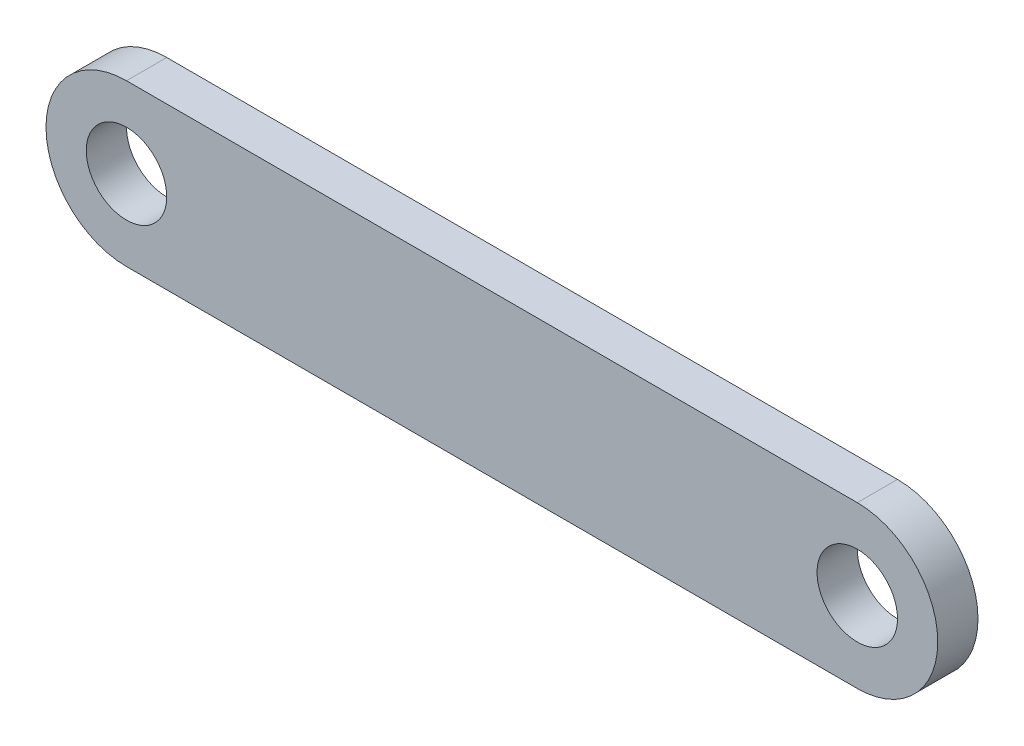
from build123d import *

# Parameters (mm, degrees)
SKETCH1_R      = 1
EXTRUDE1_DEPTH = 1


with BuildPart() as part:
    # Sketch1 → Extrude1 (new body)
    with BuildSketch(Plane.XY):
        with BuildLine():
            ThreePointArc((0, 2), (-2, 0), (0, -2))
            Line((0, -2), (18.16, -2))
            ThreePointArc((18.16, -2), (20.16, 0), (18.16, 2))
            Line((18.16, 2), (0, 2))
        make_face()
        Circle(SKETCH1_R, mode=Mode.SUBTRACT)
        with Locations((18.16, 0)):
            Circle(SKETCH1_R, mode=Mode.SUBTRACT)
    extrude(amount=-EXTRUDE1_DEPTH)


solid = part.part
